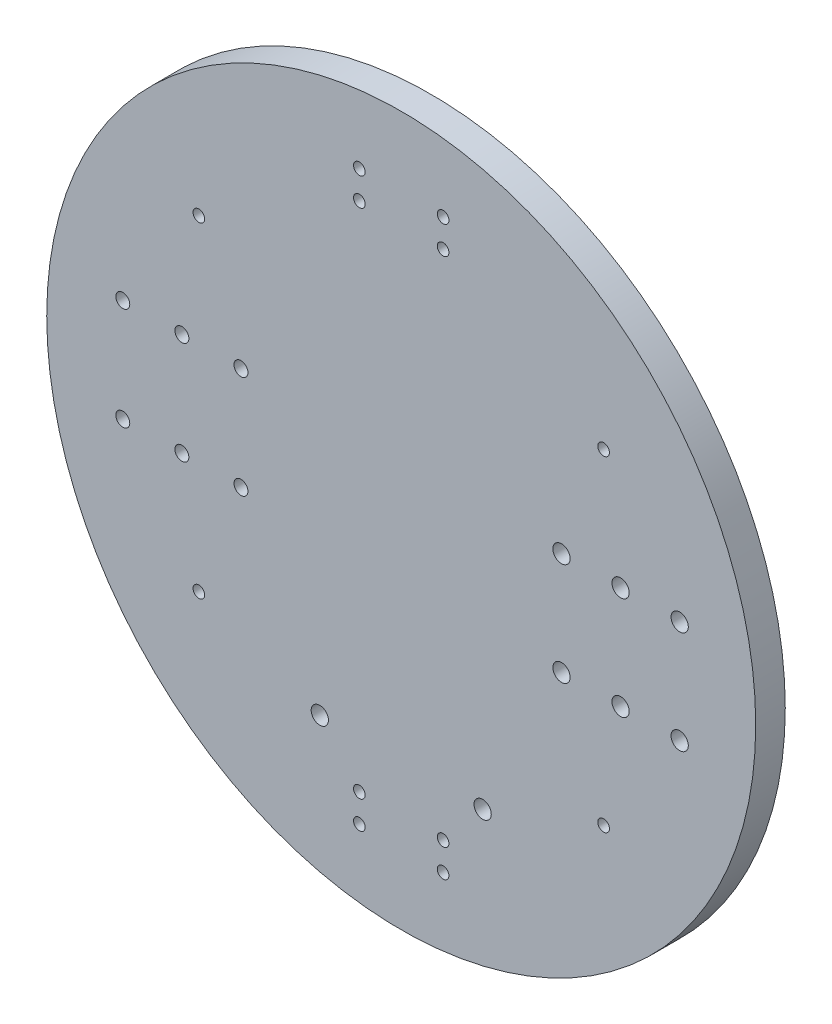
from build123d import *

# Parameters (mm, degrees)
SKETCH1_R           = 76.2
BOSS_EXTRUDE1_DEPTH = 6.35
SKETCH2_R           = 1.25
SKETCH2_R_2         = 1.855
CUT_EXTRUDE1_DEPTH  = 108.95
SKETCH3_R           = 1.855
CUT_EXTRUDE2_DEPTH  = 108.95
SKETCH5_R           = 1.25
SKETCH5_R_2         = 1.5
CUT_EXTRUDE3_DEPTH  = 10


with BuildPart() as part:
    # Sketch1 → Boss-Extrude1 (new body)
    with BuildSketch(Plane.XY):
        Circle(SKETCH1_R)
    extrude(amount=BOSS_EXTRUDE1_DEPTH)

    # Sketch2 → Cut-Extrude1 (cut, through all)
    with BuildSketch(Plane.XY.offset(6.35)):
        with Locations((-43.5, 35)):
            Circle(SKETCH2_R)
        with Locations((43.5, 35)):
            Circle(SKETCH2_R)
        with Locations((-43.5, -35)):
            Circle(SKETCH2_R)
        with Locations((43.5, -35)):
            Circle(SKETCH2_R)
        with Locations((17.5, -45)):
            Circle(SKETCH2_R_2)
        with Locations((-17.5, -45)):
            Circle(SKETCH2_R_2)
        with Locations((9, -61)):
            Circle(SKETCH2_R)
        with Locations((-9, -61)):
            Circle(SKETCH2_R)
        with Locations((-9, -55)):
            Circle(SKETCH2_R)
        with Locations((9, -55)):
            Circle(SKETCH2_R)
    extrude(amount=-CUT_EXTRUDE1_DEPTH, mode=Mode.SUBTRACT)

    # Sketch3 → Cut-Extrude2 (cut, through all)
    with BuildSketch(Plane(origin=(0, 0, 0), x_dir=(-1, 0, 0), z_dir=(0, 0, -1))):
        with Locations((-59.85, 11.05)):
            Circle(SKETCH3_R)
        with Locations((-47.15, 11.05)):
            Circle(SKETCH3_R)
        with Locations((-34.45, 11.05)):
            Circle(SKETCH3_R)
        with Locations((-34.45, -11.05)):
            Circle(SKETCH3_R)
        with Locations((-47.15, -11.05)):
            Circle(SKETCH3_R)
        with Locations((-59.85, -11.05)):
            Circle(SKETCH3_R)
    extrude(amount=-CUT_EXTRUDE2_DEPTH, mode=Mode.SUBTRACT)

    # Sketch5 → Cut-Extrude3 (cut)
    with BuildSketch(Plane(origin=(0, 0, 0), x_dir=(-1, 0, 0), z_dir=(0, 0, -1))):
        with Locations((-9, 61)):
            Circle(SKETCH5_R)
        with Locations((-9, 55)):
            Circle(SKETCH5_R)
        with Locations((9, 61)):
            Circle(SKETCH5_R)
        with Locations((9, 55)):
            Circle(SKETCH5_R)
        with Locations((34.45, 11.05)):
            Circle(SKETCH5_R_2)
        with Locations((47.15, 11.05)):
            Circle(SKETCH5_R_2)
        with Locations((59.85, 11.05)):
            Circle(SKETCH5_R_2)
        with Locations((59.85, -11.05)):
            Circle(SKETCH5_R_2)
        with Locations((47.15, -11.05)):
            Circle(SKETCH5_R_2)
        with Locations((34.45, -11.05)):
            Circle(SKETCH5_R_2)
    extrude(amount=-CUT_EXTRUDE3_DEPTH, mode=Mode.SUBTRACT)


solid = part.part
